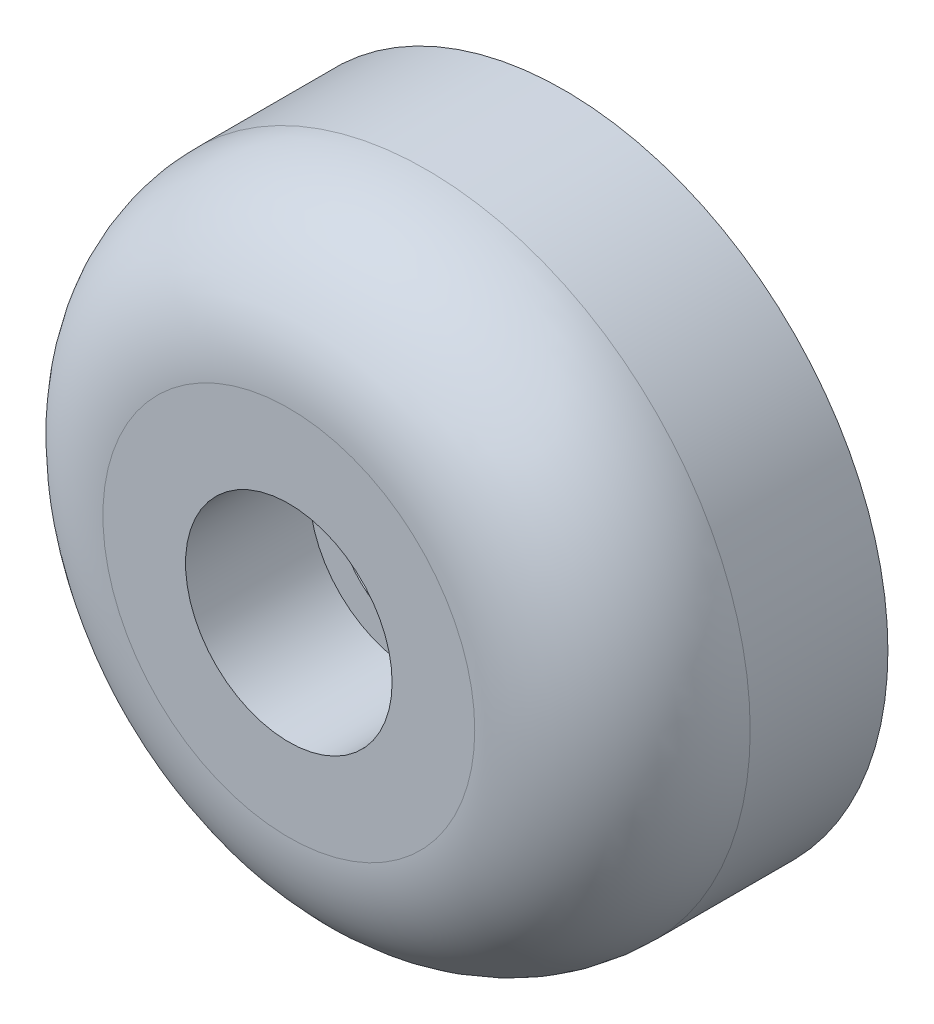
from build123d import *

# Parameters (mm, degrees)
SKETCH_2_R          = 23.5
EXTRUDE_1_DEPTH     = 20
FILLET_3_R          = 10
SHELL_2_T           = -2
SKETCH_5_R          = 9.5
EXTRUDE_2_DEPTH     = 18
SKETCH_6_R          = 2.4
CUT_EXTRUDE_1_DEPTH = 39.787884706
EXTRUDE_3_REACH     = 40.788
SKETCH_7_W          = 1.2
SKETCH_7_H          = 13
SKETCH_8_R          = 7.5
CUT_EXTRUDE_2_DEPTH = 9
CHAMFER_1_SIZE      = 3


with BuildPart() as part:
    # Эскиз2 → Бобышка-Вытянуть1 (new body)
    with BuildSketch(Plane.XY):
        Circle(SKETCH_2_R)
    extrude(amount=EXTRUDE_1_DEPTH)

    # Скругление3
    fillet_3_edges = [part.edges().sort_by_distance(p)[0] for p in [
        (-23.5, 0, 20),
    ]]
    fillet(fillet_3_edges, radius=FILLET_3_R)

    # Оболочка2
    shell_2_openings = [part.faces().sort_by_distance(p)[0] for p in [
        (0, 0, 0),
    ]]
    offset(amount=SHELL_2_T, openings=shell_2_openings, kind=Kind.INTERSECTION)

    # Эскиз5 → Бобышка-Вытянуть2 (add)
    with BuildSketch(Plane(origin=(0, 0, 18), x_dir=(-1, 0, 0), z_dir=(0, 0, -1))):
        with Locations(Location((0, 0, 0), (0, 0, 180))):
            Circle(SKETCH_5_R)
    extrude(amount=EXTRUDE_2_DEPTH)

    # Эскиз6 → Вырез-Вытянуть1 (cut, through all)
    with BuildSketch(Plane(origin=(0, 0, 0), x_dir=(-1, 0, 0), z_dir=(0, 0, -1))):
        Circle(SKETCH_6_R)
    extrude(amount=-CUT_EXTRUDE_1_DEPTH, mode=Mode.SUBTRACT)

    # Эскиз7 → Бобышка-Вытянуть3 (add, up to next)
    with BuildSketch(Plane(origin=(0, 0, 0), x_dir=(-1, 0, 0), z_dir=(0, 0, -1)), mode=Mode.PRIVATE) as extrude_3_sk1:
        with Locations((0, 15.437627965)):
            Rectangle(SKETCH_7_W, SKETCH_7_H)
    extrude_3_tool1 = extrude(extrude_3_sk1.sketch, amount=-EXTRUDE_3_REACH, mode=Mode.PRIVATE) - part.part
    # Эскиз7 → Бобышка-Вытянуть3 (add, up to next)
    with BuildSketch(Plane(origin=(0, 0, 0), x_dir=(-1, 0, 0), z_dir=(0, 0, -1)), mode=Mode.PRIVATE) as extrude_3_sk2:
        Polygon((7.440212867, 4.988429225), (18.698543116, 11.488429225), (19.298543116, 10.44919874), (8.040212867, 3.94919874), align=None)
    extrude_3_tool2 = extrude(extrude_3_sk2.sketch, amount=-EXTRUDE_3_REACH, mode=Mode.PRIVATE) - part.part
    # Эскиз7 → Бобышка-Вытянуть3 (add, up to next)
    with BuildSketch(Plane(origin=(0, 0, 0), x_dir=(-1, 0, 0), z_dir=(0, 0, -1)), mode=Mode.PRIVATE) as extrude_3_sk3:
        Polygon((8.040212867, -3.94919874), (19.298543117, -10.44919874), (18.698543117, -11.488429225), (7.440212867, -4.988429225), align=None)
    extrude_3_tool3 = extrude(extrude_3_sk3.sketch, amount=-EXTRUDE_3_REACH, mode=Mode.PRIVATE) - part.part
    # Эскиз7 → Бобышка-Вытянуть3 (add, up to next)
    with BuildSketch(Plane(origin=(0, 0, 0), x_dir=(-1, 0, 0), z_dir=(0, 0, -1)), mode=Mode.PRIVATE) as extrude_3_sk4:
        with Locations((0, -15.437627965)):
            Rectangle(SKETCH_7_W, SKETCH_7_H)
    extrude_3_tool4 = extrude(extrude_3_sk4.sketch, amount=-EXTRUDE_3_REACH, mode=Mode.PRIVATE) - part.part
    # Эскиз7 → Бобышка-Вытянуть3 (add, up to next)
    with BuildSketch(Plane(origin=(0, 0, 0), x_dir=(-1, 0, 0), z_dir=(0, 0, -1)), mode=Mode.PRIVATE) as extrude_3_sk5:
        Polygon((-7.440212867, -4.988429225), (-18.698543116, -11.488429225), (-19.298543116, -10.44919874), (-8.040212867, -3.94919874), align=None)
    extrude_3_tool5 = extrude(extrude_3_sk5.sketch, amount=-EXTRUDE_3_REACH, mode=Mode.PRIVATE) - part.part
    # Эскиз7 → Бобышка-Вытянуть3 (add, up to next)
    with BuildSketch(Plane(origin=(0, 0, 0), x_dir=(-1, 0, 0), z_dir=(0, 0, -1)), mode=Mode.PRIVATE) as extrude_3_sk6:
        Polygon((-8.040212867, 3.94919874), (-19.298543116, 10.44919874), (-18.698543116, 11.488429225), (-7.440212867, 4.988429225), align=None)
    extrude_3_tool6 = extrude(extrude_3_sk6.sketch, amount=-EXTRUDE_3_REACH, mode=Mode.PRIVATE) - part.part
    add(extrude_3_tool1.solids().sort_by_distance((0, 15.437628, 0))[0])
    add(extrude_3_tool2.solids().sort_by_distance((-13.369378, 7.718814, 0))[0])
    add(extrude_3_tool3.solids().sort_by_distance((-13.369378, -7.718814, 0))[0])
    add(extrude_3_tool4.solids().sort_by_distance((0, -15.437628, 0))[0])
    add(extrude_3_tool5.solids().sort_by_distance((13.369378, -7.718814, 0))[0])
    add(extrude_3_tool6.solids().sort_by_distance((13.369378, 7.718814, 0))[0])

    # Эскиз8 → Вырез-Вытянуть2 (cut)
    with BuildSketch(Plane.XY.offset(20)):
        Circle(SKETCH_8_R)
    extrude(amount=-CUT_EXTRUDE_2_DEPTH, mode=Mode.SUBTRACT)

    # Фаска1
    chamfer_1_edges = [part.edges().sort_by_distance(p)[0] for p in [
        (2.4, 0, 11),
    ]]
    chamfer(chamfer_1_edges, length=CHAMFER_1_SIZE)


solid = part.part
